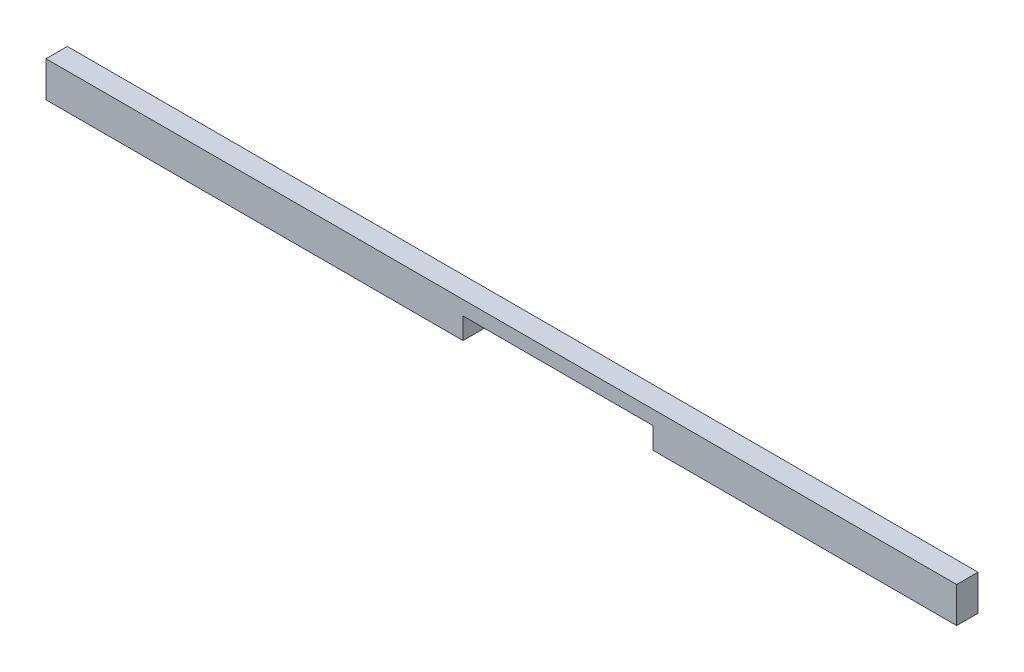
from build123d import *

# Parameters (mm, degrees)
SKETCH1_W           = 812.8
SKETCH1_H           = 19.05
BOSS_EXTRUDE1_DEPTH = 31.75
SKETCH2_W           = 169.388632852
SKETCH2_H           = 19.05
CUT_EXTRUDE1_DEPTH  = 409.083232932


with BuildPart() as part:
    # Sketch1 → Boss-Extrude1 (new body)
    with BuildSketch(Plane(origin=(0, 0, 0), x_dir=(1, 0, 0), z_dir=(0, 1, 0))):
        Rectangle(SKETCH1_W, SKETCH1_H)
    extrude(amount=BOSS_EXTRUDE1_DEPTH)

    # Sketch2 → Cut-Extrude1 (cut, through all)
    with BuildSketch(Plane(origin=(0, 0, -9.525), x_dir=(-1, 0, 0), z_dir=(0, 0, -1))):
        with Locations((-50.51182299, 9.525)):
            Rectangle(SKETCH2_W, SKETCH2_H)
    extrude(amount=-CUT_EXTRUDE1_DEPTH, mode=Mode.SUBTRACT)


solid = part.part
